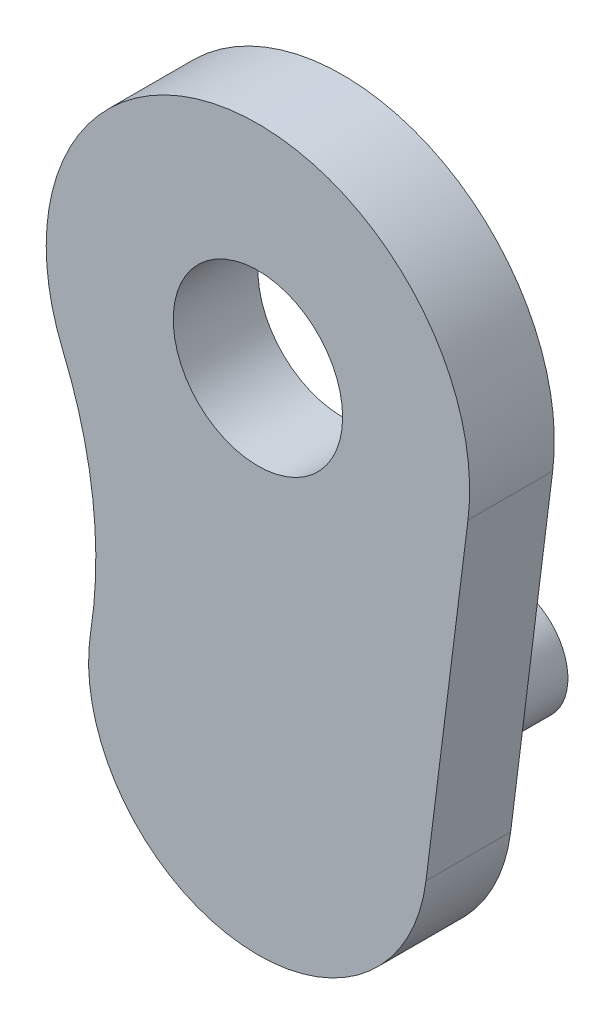
from build123d import *

# Parameters (mm, degrees)
SKETCH_1_R      = 10
EXTRUDE_1_DEPTH = 10
SKETCH_2_R      = 6.599829968
EXTRUDE_2_DEPTH = 20


with BuildPart() as part:
    # 草图1 → 凸台-拉伸1 (new body)
    with BuildSketch(Plane.XY):
        with BuildLine():
            Line((24.803918541, -3.125), (19.843134833, -42.5))
            ThreePointArc((19.843134833, -42.5), (-2.812850316, -59.80120888), (-19.754350787, -36.875))
            ThreePointArc((-19.754350787, -36.875), (-19.502870979, -23.051442481), (-23.046742584, -9.6875))
            ThreePointArc((-23.046742584, -9.6875), (-3.396839472, 24.768154586), (24.803918541, -3.125))
        make_face()
        Circle(SKETCH_1_R, mode=Mode.SUBTRACT)
    extrude(amount=EXTRUDE_1_DEPTH)

    # 草图2 → 凸台-拉伸2 (add)
    with BuildSketch(Plane(origin=(0, 0, 0), x_dir=(-1, 0, 0), z_dir=(0, 0, -1))):
        with Locations((0, -43.431952643)):
            Circle(SKETCH_2_R)
    extrude(amount=EXTRUDE_2_DEPTH)


solid = part.part
